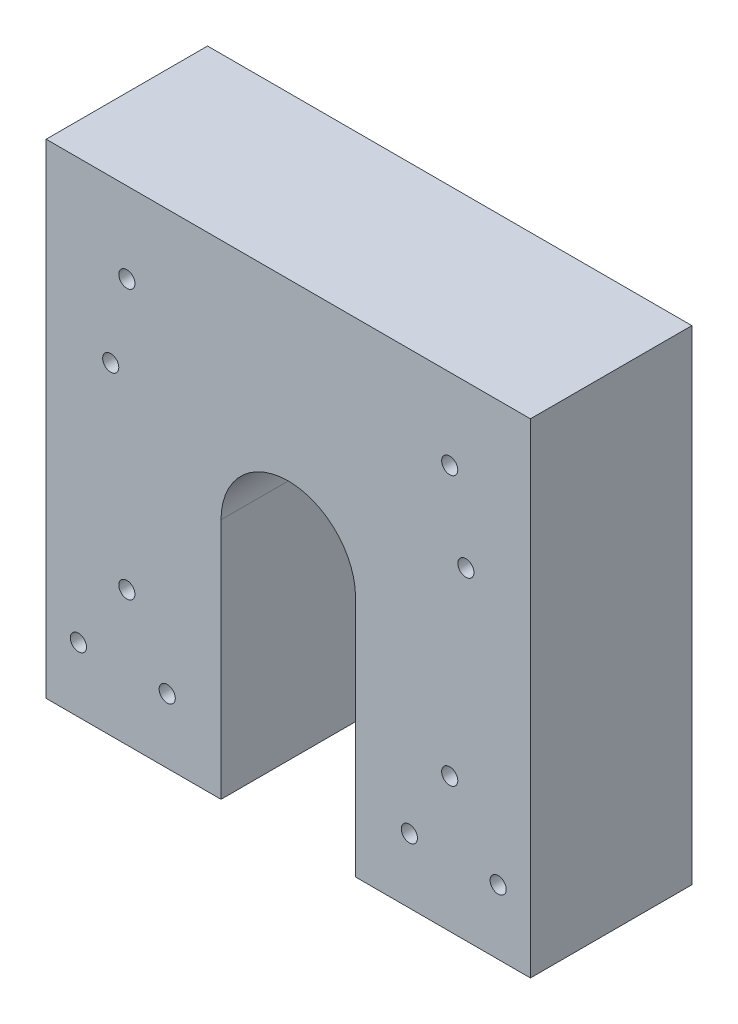
from build123d import *

# Parameters (mm, degrees)
SKETCH1_W           = 90
SKETCH1_H           = 90
BOSS_EXTRUDE1_DEPTH = 30
SKETCH2_R           = 4
CUT_EXTRUDE1_DEPTH  = 40
SKETCH3_R           = 12.5
CUT_EXTRUDE2_DEPTH  = 35
SKETCH5_R           = 1.5
CUT_EXTRUDE3_DEPTH  = 40
SKETCH9_R           = 1.5
CUT_EXTRUDE4_DEPTH  = 15


with BuildPart() as part:
    # Sketch1 → Boss-Extrude1 (new body)
    with BuildSketch(Plane.XY):
        Rectangle(SKETCH1_W, SKETCH1_H)
    extrude(amount=BOSS_EXTRUDE1_DEPTH)

    # Sketch2 → Cut-Extrude1 (cut)
    with BuildSketch(Plane.XZ.offset(45)):
        with Locations(Location((-30, 15, 0), (0, 0, 270))):
            Circle(SKETCH2_R)
        with Locations(Location((30, 15, 0), (0, 0, 270))):
            Circle(SKETCH2_R)
    extrude(amount=-CUT_EXTRUDE1_DEPTH, mode=Mode.SUBTRACT)

    # Sketch3 → Cut-Extrude2 (cut)
    with BuildSketch(Plane.XY.offset(30)):
        with BuildLine():
            Line((12.5, -45), (12.5, 0))
            ThreePointArc((12.5, 0), (0, -12.5), (-12.5, 0))
            Line((-12.5, 0), (-12.5, -45))
            Line((-12.5, -45), (12.5, -45))
        make_face()
        Circle(SKETCH3_R)
    extrude(amount=-CUT_EXTRUDE2_DEPTH, mode=Mode.SUBTRACT)

    # Sketch5 → Cut-Extrude3 (cut)
    with BuildSketch(Plane.XY.offset(30)):
        with Locations((-30, 30)):
            Circle(SKETCH5_R)
        with Locations((-33, 15)):
            Circle(SKETCH5_R)
        with Locations((30, 30)):
            Circle(SKETCH5_R)
        with Locations((33, 15)):
            Circle(SKETCH5_R)
        with Locations((39, -33)):
            Circle(SKETCH5_R)
        with Locations((22.5, -33)):
            Circle(SKETCH5_R)
        with Locations((-22.5, -33)):
            Circle(SKETCH5_R)
        with Locations((-39, -33)):
            Circle(SKETCH5_R)
    extrude(amount=-CUT_EXTRUDE3_DEPTH, mode=Mode.SUBTRACT)

    # Sketch9 → Cut-Extrude4 (cut)
    with BuildSketch(Plane.XY.offset(30)):
        with Locations((-30, -20)):
            Circle(SKETCH9_R)
        with Locations((30, -20)):
            Circle(SKETCH9_R)
    extrude(amount=-CUT_EXTRUDE4_DEPTH, mode=Mode.SUBTRACT)


solid = part.part
